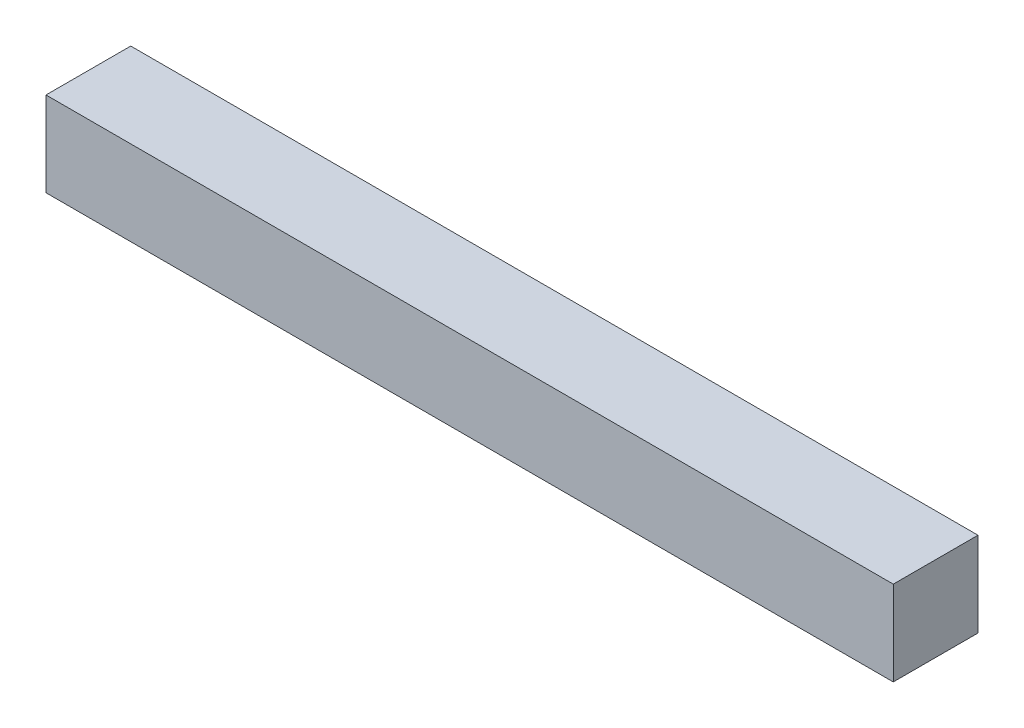
from build123d import *

# Parameters (mm, degrees)
SKETCH1_W           = 30
SKETCH1_H           = 30
BOSS_EXTRUDE1_DEPTH = 300


with BuildPart() as part:
    # Sketch1 → Boss-Extrude1 (new body)
    with BuildSketch(Plane(origin=(0, 0, 0), x_dir=(0, 0, -1), z_dir=(1, 0, 0))):
        with Locations((-25, 10.806451613)):
            Rectangle(SKETCH1_W, SKETCH1_H)
    extrude(amount=BOSS_EXTRUDE1_DEPTH)


solid = part.part
